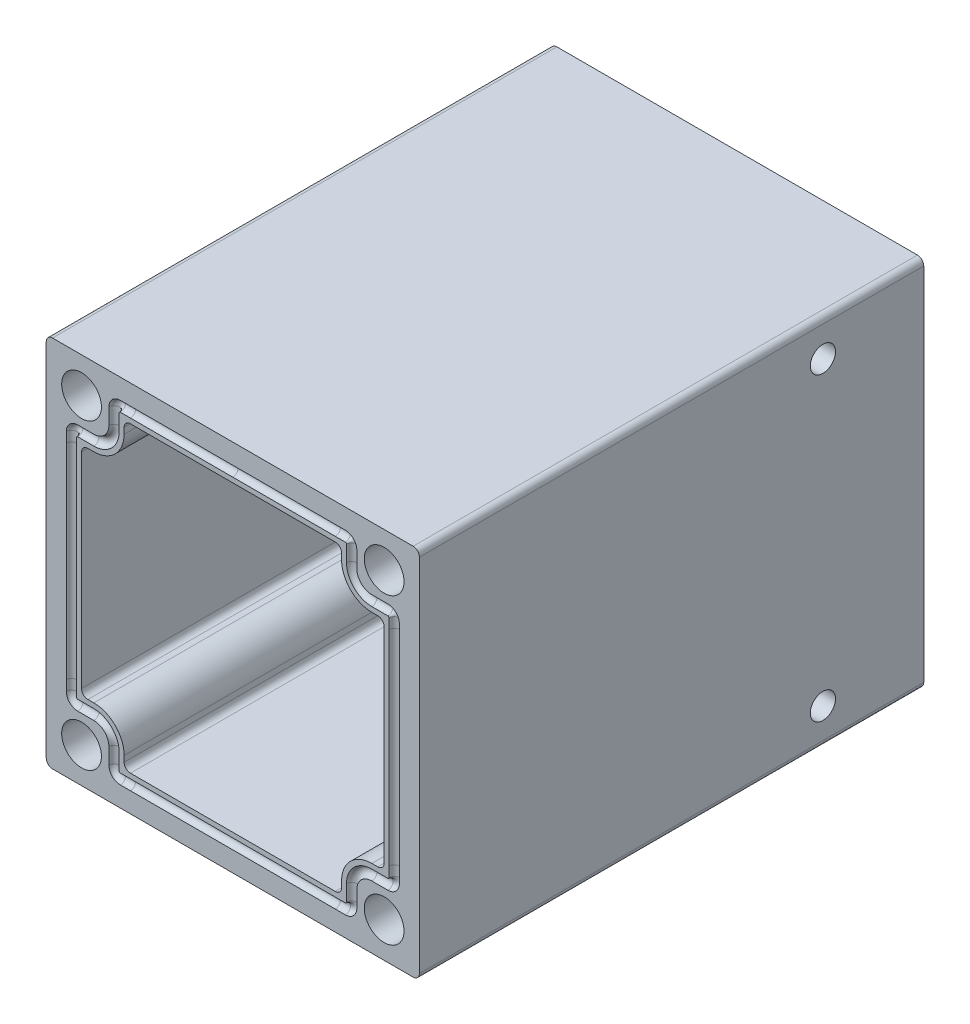
from build123d import *

# Parameters (mm, degrees)
BOSS_EXTRUDE1_DEPTH = 63.5
SKETCH7_R           = 0.65
SKETCH10_R          = 2.5019
CUT_EXTRUDE3_DEPTH  = 12.7
BOSS_EXTRUDE2_START = -60.325
SKETCH12_R          = 10.414
BOSS_EXTRUDE2_DEPTH = 3.175
SKETCH14_R          = 1.5875
CUT_EXTRUDE4_DEPTH  = 6.35


with BuildPart() as part:
    # Sketch1 → Boss-Extrude1 (new body)
    with BuildSketch(Plane.XY):
        with BuildLine():
            Line((23.495, 22.70125), (23.495, -22.70125))
            ThreePointArc((23.495, -22.70125), (23.262516008, -23.262516008), (22.70125, -23.495))
            Line((22.70125, -23.495), (-22.70125, -23.495))
            ThreePointArc((-22.70125, -23.495), (-23.262516008, -23.262516008), (-23.495, -22.70125))
            Line((-23.495, -22.70125), (-23.495, 22.70125))
            ThreePointArc((-23.495, 22.70125), (-23.262516008, 23.262516008), (-22.70125, 23.495))
            Line((-22.70125, 23.495), (22.70125, 23.495))
            ThreePointArc((22.70125, 23.495), (23.262516008, 23.262516008), (23.495, 22.70125))
        make_face()
        with BuildLine():
            Line((-12.89685, -19.05), (12.89685, -19.05))
            ThreePointArc((12.89685, -19.05), (13.458116008, -18.817516008), (13.6906, -18.25625))
            Line((13.6906, -18.25625), (13.6906, -17.5006))
            ThreePointArc((13.6906, -17.5006), (14.806523164, -14.806523164), (17.5006, -13.6906))
            Line((17.5006, -13.6906), (18.25625, -13.6906))
            ThreePointArc((18.25625, -13.6906), (18.817516008, -13.458116008), (19.05, -12.89685))
            Line((19.05, -12.89685), (19.05, 12.89685))
            ThreePointArc((19.05, 12.89685), (18.817516008, 13.458116008), (18.25625, 13.6906))
            Line((18.25625, 13.6906), (17.5006, 13.6906))
            ThreePointArc((17.5006, 13.6906), (14.806523164, 14.806523164), (13.6906, 17.5006))
            Line((13.6906, 17.5006), (13.6906, 18.25625))
            ThreePointArc((13.6906, 18.25625), (13.458116008, 18.817516008), (12.89685, 19.05))
            Line((12.89685, 19.05), (-12.89685, 19.05))
            ThreePointArc((-12.89685, 19.05), (-13.458116008, 18.817516008), (-13.6906, 18.25625))
            Line((-13.6906, 18.25625), (-13.6906, 17.5006))
            ThreePointArc((-13.6906, 17.5006), (-14.806523164, 14.806523164), (-17.5006, 13.6906))
            Line((-17.5006, 13.6906), (-18.25625, 13.6906))
            ThreePointArc((-18.25625, 13.6906), (-18.817516008, 13.458116008), (-19.05, 12.89685))
            Line((-19.05, 12.89685), (-19.05, -12.89685))
            ThreePointArc((-19.05, -12.89685), (-18.817516008, -13.458116008), (-18.25625, -13.6906))
            Line((-18.25625, -13.6906), (-17.5006, -13.6906))
            ThreePointArc((-17.5006, -13.6906), (-14.806523164, -14.806523164), (-13.6906, -17.5006))
            Line((-13.6906, -17.5006), (-13.6906, -18.25625))
            ThreePointArc((-13.6906, -18.25625), (-13.458116008, -18.817516008), (-12.89685, -19.05))
        make_face(mode=Mode.SUBTRACT)
    extrude(amount=-BOSS_EXTRUDE1_DEPTH)

    # Cut-Sweep2: sweep along a path in Sketch11
    with BuildLine(Plane.XY) as cut_sweep2_path:
        Line((-14.9606, 19.52625), (-14.9606, 17.5006))
        ThreePointArc((-14.9606, 17.5006), (-15.704548776, 15.704548776), (-17.5006, 14.9606))
        Line((-17.5006, 14.9606), (-19.52625, 14.9606))
        ThreePointArc((-19.52625, 14.9606), (-20.087516008, 14.728116008), (-20.32, 14.16685))
        Line((-20.32, 14.16685), (-20.32, 12.89685))
        Line((-20.32, 12.89685), (-20.32, -12.89685))
        Line((-20.32, -12.89685), (-20.32, -14.16685))
        ThreePointArc((-20.32, -14.16685), (-20.087516008, -14.728116008), (-19.52625, -14.9606))
        Line((-19.52625, -14.9606), (-17.5006, -14.9606))
        ThreePointArc((-17.5006, -14.9606), (-15.704548776, -15.704548776), (-14.9606, -17.5006))
        Line((-14.9606, -17.5006), (-14.9606, -19.52625))
        ThreePointArc((-14.9606, -19.52625), (-14.728116008, -20.087516008), (-14.16685, -20.32))
        Line((-14.16685, -20.32), (-12.89685, -20.32))
        Line((-12.89685, -20.32), (12.89685, -20.32))
        Line((12.89685, -20.32), (14.16685, -20.32))
        ThreePointArc((14.16685, -20.32), (14.728116008, -20.087516008), (14.9606, -19.52625))
        Line((14.9606, -19.52625), (14.9606, -17.5006))
        ThreePointArc((14.9606, -17.5006), (15.704548776, -15.704548776), (17.5006, -14.9606))
        Line((17.5006, -14.9606), (19.52625, -14.9606))
        ThreePointArc((19.52625, -14.9606), (20.087516008, -14.728116008), (20.32, -14.16685))
        Line((20.32, -14.16685), (20.32, -12.89685))
        Line((20.32, -12.89685), (20.32, 12.89685))
        Line((20.32, 12.89685), (20.32, 14.16685))
        ThreePointArc((20.32, 14.16685), (20.087516008, 14.728116008), (19.52625, 14.9606))
        Line((19.52625, 14.9606), (17.5006, 14.9606))
        ThreePointArc((17.5006, 14.9606), (15.704548776, 15.704548776), (14.9606, 17.5006))
        Line((14.9606, 17.5006), (14.9606, 19.52625))
        ThreePointArc((14.9606, 19.52625), (14.728116008, 20.087516008), (14.16685, 20.32))
        Line((14.16685, 20.32), (12.89685, 20.32))
        Line((12.89685, 20.32), (-12.89685, 20.32))
        Line((-12.89685, 20.32), (-14.16685, 20.32))
        ThreePointArc((-14.16685, 20.32), (-14.728116008, 20.087516008), (-14.9606, 19.52625))
    # Sketch7 → Cut-Sweep2 (sweep, cut)
    with BuildSketch(Plane(origin=(0, 0, 0), x_dir=(0, 0, -1), z_dir=(1, 0, 0))):
        with Locations((0, 20.32)):
            Circle(SKETCH7_R)
    sweep(path=cut_sweep2_path.line, mode=Mode.SUBTRACT)

    # Sketch10 → Cut-Extrude3 (cut)
    with BuildSketch(Plane.XY):
        with Locations((19.05, 19.05)):
            Circle(SKETCH10_R)
        with Locations((19.05, -19.05)):
            Circle(SKETCH10_R)
        with Locations((-19.05, -19.05)):
            Circle(SKETCH10_R)
        with Locations((-19.05, 19.05)):
            Circle(SKETCH10_R)
    extrude(amount=-CUT_EXTRUDE3_DEPTH, mode=Mode.SUBTRACT)

    # Sketch12 → Boss-Extrude2 (add)
    with BuildSketch(Plane.XY.offset(BOSS_EXTRUDE2_START)):
        with BuildLine():
            Line((23.495, 22.70125), (23.495, -22.70125))
            ThreePointArc((23.495, -22.70125), (23.262516008, -23.262516008), (22.70125, -23.495))
            Line((22.70125, -23.495), (-22.70125, -23.495))
            ThreePointArc((-22.70125, -23.495), (-23.262516008, -23.262516008), (-23.495, -22.70125))
            Line((-23.495, -22.70125), (-23.495, 22.70125))
            ThreePointArc((-23.495, 22.70125), (-23.262516008, 23.262516008), (-22.70125, 23.495))
            Line((-22.70125, 23.495), (22.70125, 23.495))
            ThreePointArc((22.70125, 23.495), (23.262516008, 23.262516008), (23.495, 22.70125))
        make_face()
        Circle(SKETCH12_R, mode=Mode.SUBTRACT)
    extrude(amount=-BOSS_EXTRUDE2_DEPTH)

    # Sketch14 → Cut-Extrude4 (cut)
    with BuildSketch(Plane(origin=(23.495, 0, 0), x_dir=(0, 0, -1), z_dir=(1, 0, 0))):
        with Locations(Location((50.8, 18.923, 0), (0, 0, 90))):
            Circle(SKETCH14_R)
        with Locations(Location((50.8, -18.923, 0), (0, 0, 90))):
            Circle(SKETCH14_R)
    extrude(amount=-CUT_EXTRUDE4_DEPTH, mode=Mode.SUBTRACT)


solid = part.part
